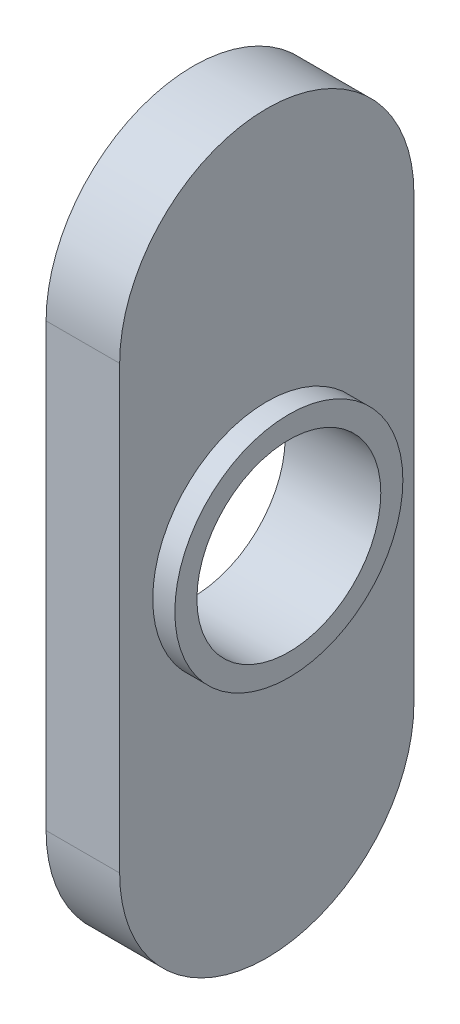
from build123d import *

# Parameters (mm, degrees)
SKETCH1_R           = 3.175
BOSS_EXTRUDE1_DEPTH = 2.54
SKETCH2_R           = 3.937
SKETCH2_R_2         = 3.175
BOSS_EXTRUDE2_DEPTH = 0.762


with BuildPart() as part:
    # Sketch1 → Boss-Extrude1 (new body)
    with BuildSketch(Plane(origin=(0, 0, 0), x_dir=(0, 0, -1), z_dir=(1, 0, 0))):
        with BuildLine():
            Line((5.08, 7.62), (5.08, -7.62))
            ThreePointArc((5.08, -7.62), (0, -12.7), (-5.08, -7.62))
            Line((-5.08, -7.62), (-5.08, 7.62))
            ThreePointArc((-5.08, 7.62), (0, 12.7), (5.08, 7.62))
        make_face()
        Circle(SKETCH1_R, mode=Mode.SUBTRACT)
    extrude(amount=BOSS_EXTRUDE1_DEPTH)

    # Sketch2 → Boss-Extrude2 (add)
    with BuildSketch(Plane(origin=(2.54, 0, 0), x_dir=(0, 0, -1), z_dir=(1, 0, 0))):
        Circle(SKETCH2_R)
        Circle(SKETCH2_R_2, mode=Mode.SUBTRACT)
    extrude(amount=BOSS_EXTRUDE2_DEPTH)


solid = part.part
